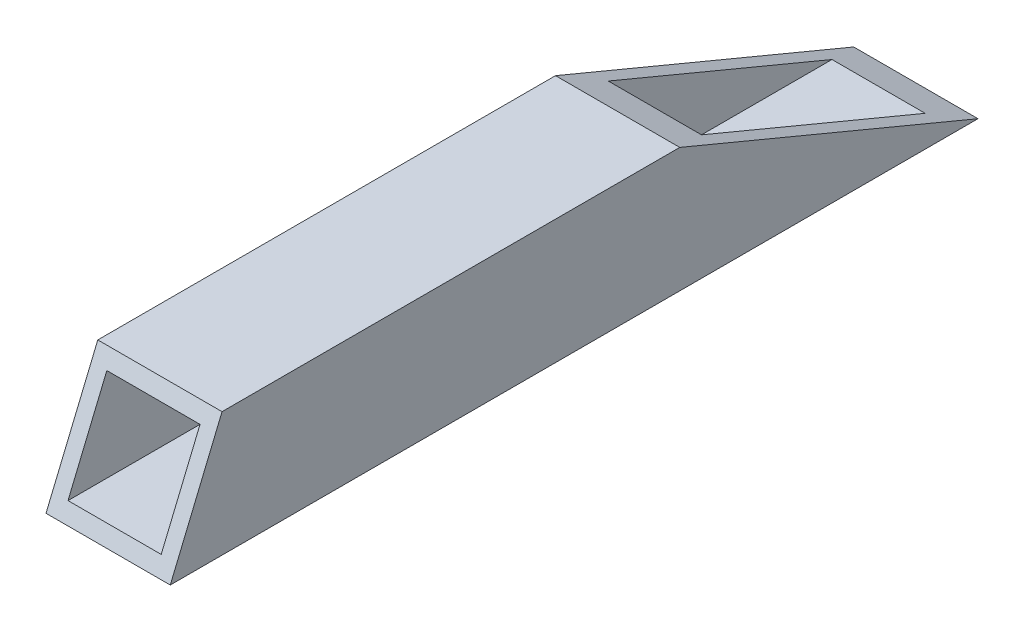
from build123d import *

# Parameters (mm, degrees)
SKETCH1_W           = 25.4
SKETCH1_H           = 25.4
SKETCH1_W_2         = 19.05
SKETCH1_H_2         = 19.05
BOSS_EXTRUDE2_DEPTH = 165.1
CUT_EXTRUDE1_REACH  = 170.963


with BuildPart() as part:
    # Sketch1 → Boss-Extrude2 (new body)
    with BuildSketch(Plane.XY):
        with Locations((12.7, 12.7)):
            Rectangle(SKETCH1_W, SKETCH1_H)
        with Locations((12.7, 12.7)):
            Rectangle(SKETCH1_W_2, SKETCH1_H_2, mode=Mode.SUBTRACT)
    extrude(amount=BOSS_EXTRUDE2_DEPTH)

    # Cut-Extrude1: up to this face of the body (flat: up to its plane)
    cut_extrude1_end = Plane(part.part.faces().sort_by_distance((0, 12.7, 82.55))[0])
    # Sketch3 → Cut-Extrude1 (cut, up to the picked face)
    with BuildSketch(Plane(origin=(25.4, 0, 0), x_dir=(0, 0, -1), z_dir=(1, 0, 0)), mode=Mode.PRIVATE) as cut_extrude1_sk1:
        Polygon((-165.1, 0), (-154.516596402, 25.4), (-165.1, 25.4), align=None)
    cut_extrude1_tool1 = split(extrude(cut_extrude1_sk1.sketch, amount=-CUT_EXTRUDE1_REACH, mode=Mode.PRIVATE), bisect_by=cut_extrude1_end, keep=Keep.BOTH, mode=Mode.PRIVATE)
    # Sketch3 → Cut-Extrude1 (cut, up to the picked face)
    with BuildSketch(Plane(origin=(25.4, 0, 0), x_dir=(0, 0, -1), z_dir=(1, 0, 0)), mode=Mode.PRIVATE) as cut_extrude1_sk2:
        Polygon((0, 0), (-60.959595279, 25.4), (0, 25.4), align=None)
    cut_extrude1_tool2 = split(extrude(cut_extrude1_sk2.sketch, amount=-CUT_EXTRUDE1_REACH, mode=Mode.PRIVATE), bisect_by=cut_extrude1_end, keep=Keep.BOTH, mode=Mode.PRIVATE)
    add(cut_extrude1_tool1.solids().sort_by(Axis((25.4, 16.933333, 161.572199), (-1, 0, 0)))[0], mode=Mode.SUBTRACT)
    add(cut_extrude1_tool2.solids().sort_by(Axis((25.4, 16.933333, 20.319865), (-1, 0, 0)))[0], mode=Mode.SUBTRACT)


solid = part.part
